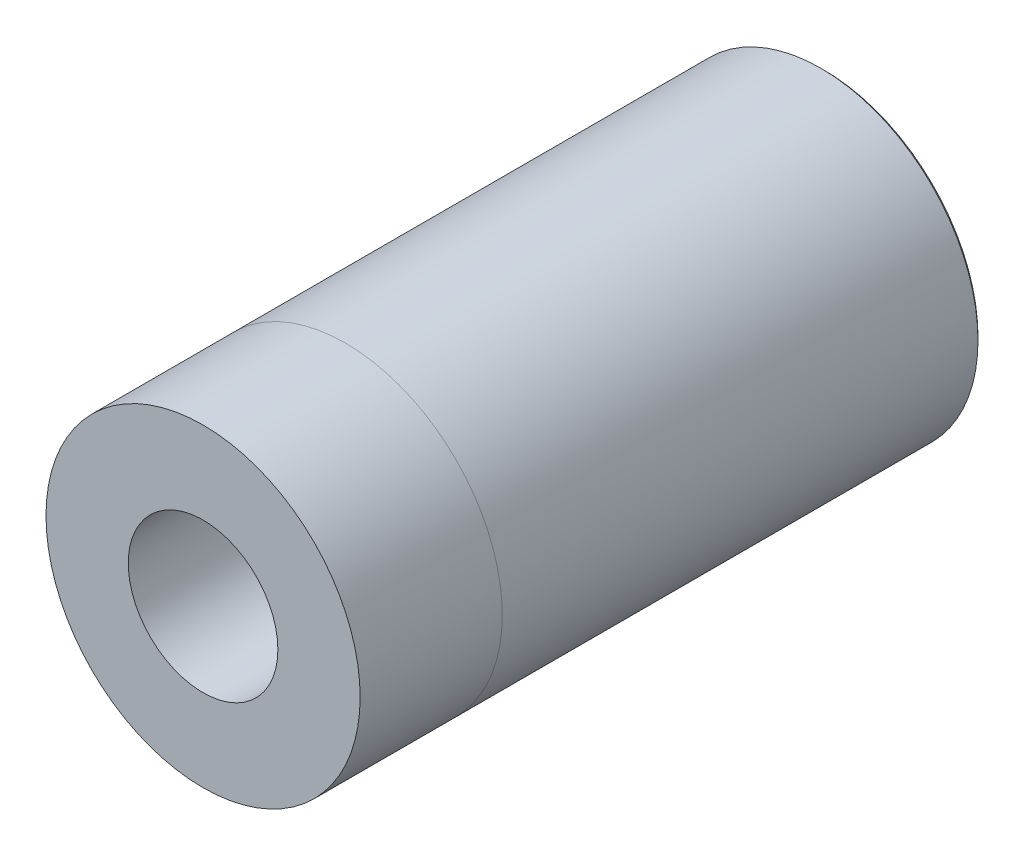
from build123d import *

# Parameters (mm, degrees)
SKETCH_1_R          = 10.5
EXTRUDE_1_DEPTH     = 32
SKETCH_2_R          = 10.5
EXTRUDE_2_DEPTH     = 9.5
SKETCH_3_R          = 5
CUT_EXTRUDE_3_DEPTH = 45.076637803
CHAMFER_1_SIZE      = 0.2


with BuildPart() as part:
    # 草图1 → 拉伸1 (new body)
    with BuildSketch(Plane.XY):
        Circle(SKETCH_1_R)
    extrude(amount=EXTRUDE_1_DEPTH)


with BuildPart() as body_2:
    # 草图2 → 拉伸2 (new body)
    with BuildSketch(Plane.XY.offset(32)):
        Circle(SKETCH_2_R)
    extrude(amount=EXTRUDE_2_DEPTH)


with BuildPart() as cut_extrude_3_tool:
    # 草图3 → 拉伸3 (new, through all)
    with BuildSketch(Plane.XY.offset(41.5)):
        Circle(SKETCH_3_R)
    extrude(amount=-CUT_EXTRUDE_3_DEPTH)


with BuildPart() as part_1:
    add(part.part)

    # 拉伸3: cut by cut_extrude_3_tool
    add(cut_extrude_3_tool.part, mode=Mode.SUBTRACT)

    # 倒角1
    chamfer_1_edges = [part_1.edges().sort_by_distance(p)[0] for p in [
        (-10.5, 0, 0),
    ]]
    chamfer(chamfer_1_edges, length=CHAMFER_1_SIZE)


with BuildPart() as body_2_1:
    add(body_2.part)

    # 拉伸3: cut by cut_extrude_3_tool
    add(cut_extrude_3_tool.part, mode=Mode.SUBTRACT)


solid = Compound([part_1.part, body_2_1.part])
